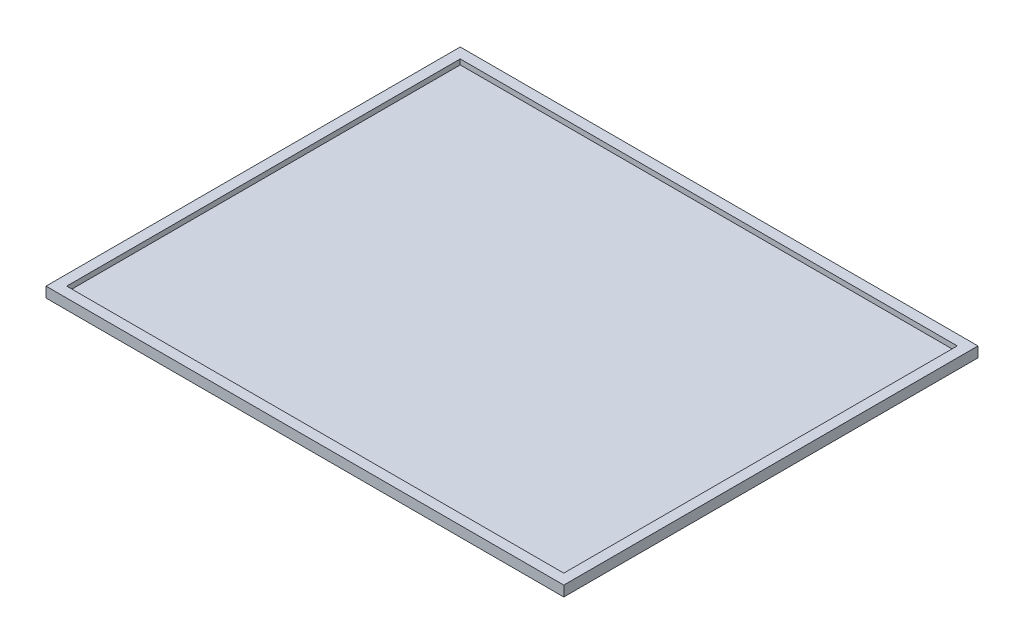
from build123d import *

# Parameters (mm, degrees)
SKETCH1_W           = 500
SKETCH1_H           = 400
SKETCH1_W_2         = 480
SKETCH1_H_2         = 380
BOSS_EXTRUDE1_DEPTH = 10
SKETCH1_3_W         = 480
SKETCH1_3_H         = 380
BOSS_EXTRUDE3_DEPTH = 5


with BuildPart() as part:
    # Sketch1 → Boss-Extrude1 (new body)
    with BuildSketch(Plane(origin=(0, 0, 0), x_dir=(1, 0, 0), z_dir=(0, 1, 0))):
        Rectangle(SKETCH1_W, SKETCH1_H)
        Rectangle(SKETCH1_W_2, SKETCH1_H_2, mode=Mode.SUBTRACT)
    extrude(amount=BOSS_EXTRUDE1_DEPTH)

    # Sketch1<3> → Boss-Extrude3 (add)
    with BuildSketch(Plane(origin=(0, 0, 0), x_dir=(1, 0, 0), z_dir=(0, 1, 0))):
        Rectangle(SKETCH1_3_W, SKETCH1_3_H)
    extrude(amount=BOSS_EXTRUDE3_DEPTH)


solid = part.part
